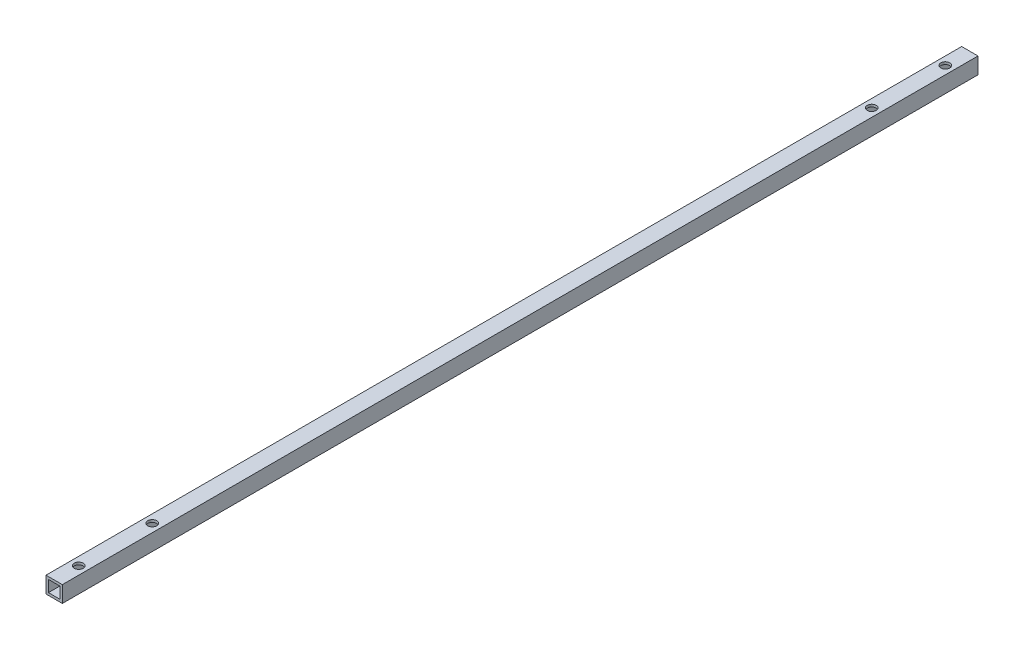
from build123d import *

# Parameters (mm, degrees)
SKIZZE1_W                       = 10
SKIZZE1_H                       = 10
SKIZZE1_W_2                     = 7
SKIZZE1_H_2                     = 7
AUFSATZ_LINEAR_AUSTRAGEN1_DEPTH = 280
SKIZZE2_R                       = 2.75
SCHNITT_LINEAR_AUSTRAGEN1_DEPTH = 15


with BuildPart() as part:
    # Skizze1 → Aufsatz-Linear austragen1 (new, symmetric)
    with BuildSketch(Plane.XY):
        Rectangle(SKIZZE1_W, SKIZZE1_H)
        Rectangle(SKIZZE1_W_2, SKIZZE1_H_2, mode=Mode.SUBTRACT)
    extrude(amount=AUFSATZ_LINEAR_AUSTRAGEN1_DEPTH, both=True)

    # Skizze2 → Schnitt-Linear austragen1 (cut, symmetric)
    with BuildSketch(Plane(origin=(0, 0, 0), x_dir=(1, 0, 0), z_dir=(0, 1, 0))):
        with Locations((0, -265)):
            Circle(SKIZZE2_R)
        with Locations((0, 265)):
            Circle(SKIZZE2_R)
        with Locations((0, -220)):
            Circle(SKIZZE2_R)
        with Locations((0, 220)):
            Circle(SKIZZE2_R)
    extrude(amount=SCHNITT_LINEAR_AUSTRAGEN1_DEPTH, both=True, mode=Mode.SUBTRACT)


solid = part.part
